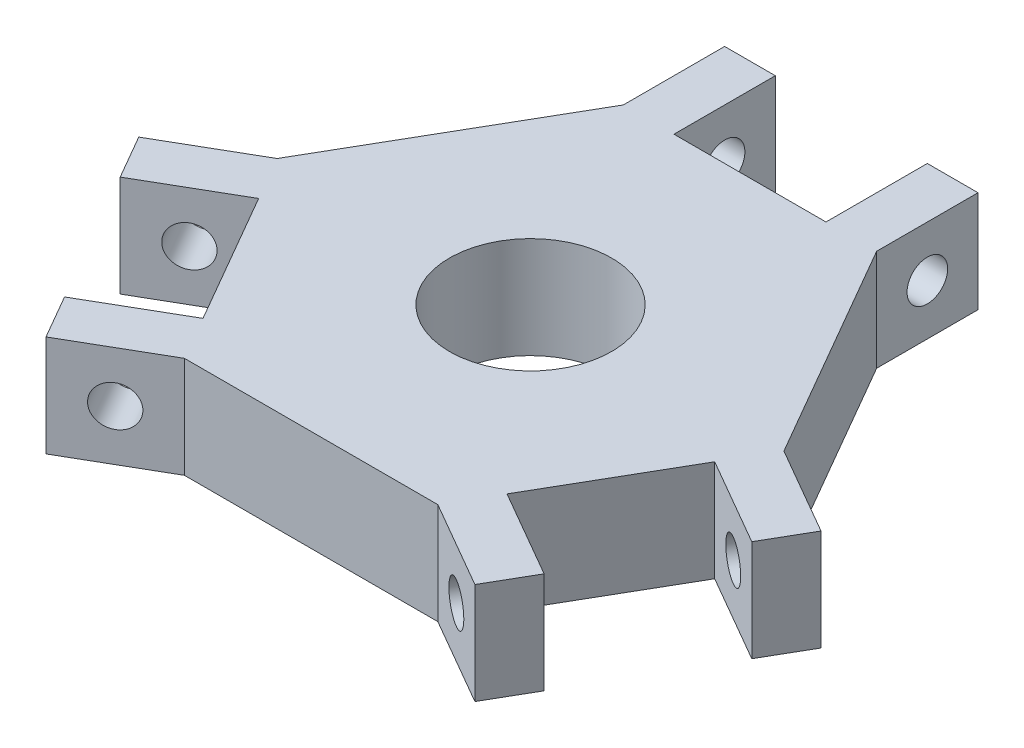
from build123d import *

# Parameters (mm, degrees)
SKETCH1_R           = 8
BOSS_EXTRUDE1_DEPTH = 5
SKETCH2_R           = 2
CUT_EXTRUDE1_DEPTH  = 15
CIRPATTERN1_COUNT   = 3


with BuildPart() as part:
    # Sketch1 → Boss-Extrude1 (new, symmetric)
    with BuildSketch(Plane(origin=(0, 0, 0), x_dir=(1, 0, 0), z_dir=(0, 1, 0))):
        Polygon((7.5, 21.650635095), (-7.5, 21.650635095), (-7.5, 31.650635095), (-12.5, 31.650635095), (-12.5, 21.650635095), (-25, 0), (-33.660254038, -5), (-31.160254038, -9.330127019), (-22.5, -4.330127019), (-15, -17.320508076), (-23.660254038, -22.320508076), (-21.160254038, -26.650635095), (-12.5, -21.650635095), (12.5, -21.650635095), (21.160254038, -26.650635095), (23.660254038, -22.320508076), (15, -17.320508076), (22.5, -4.330127019), (31.160254038, -9.330127019), (33.660254038, -5), (25, 0), (12.5, 21.650635095), (12.5, 31.650635095), (7.5, 31.650635095), align=None)
        Circle(SKETCH1_R, mode=Mode.SUBTRACT)
    extrude(amount=BOSS_EXTRUDE1_DEPTH, both=True)

    # Sketch2 → Cut-Extrude1 (cut, symmetric)
    with BuildSketch(Plane(origin=(0, 0, 0), x_dir=(0, 0, -1), z_dir=(1, 0, 0))):
        with Locations((26.650635095, 0)):
            Circle(SKETCH2_R)
    cut_extrude1 = extrude(amount=CUT_EXTRUDE1_DEPTH, both=True, mode=Mode.SUBTRACT)

    # CirPattern1: Cut-Extrude1 ×3 about axis
    cirpattern1_axis = Axis((0, 5, 0), (0, -1, 0))
    for i in range(1, CIRPATTERN1_COUNT):
        add(cut_extrude1.rotate(cirpattern1_axis, i * 360 / CIRPATTERN1_COUNT), mode=Mode.SUBTRACT)


solid = part.part
